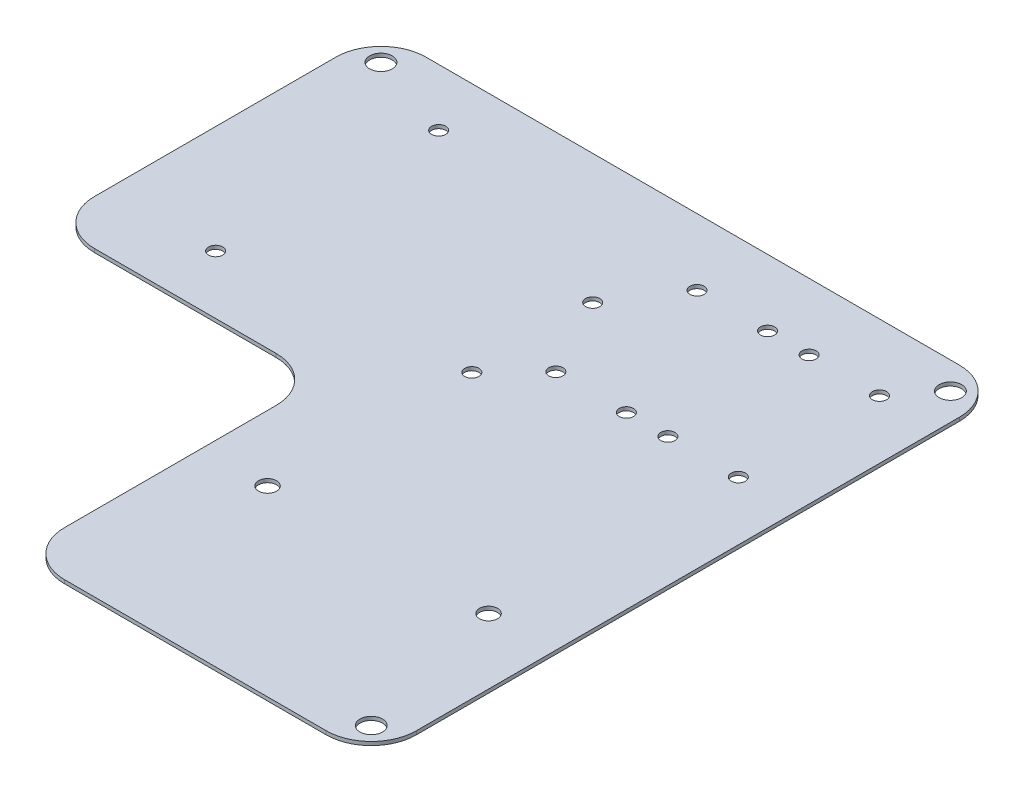
from build123d import *

# Parameters (mm, degrees)
SKETCH_1_R      = 1.57
SKETCH_1_R_2    = 2
SKETCH_1_R_3    = 2.5
EXTRUDE_1_DEPTH = 0.8


with BuildPart() as part:
    # 草图1 → 凸台-拉伸1 (new body)
    with BuildSketch(Plane(origin=(0, 0, 0), x_dir=(1, 0, 0), z_dir=(0, 1, 0))):
        with BuildLine():
            Line((-51.518366865, 90.405716602), (66.740135943, 90.405716602))
            ThreePointArc((66.740135943, 90.405716602), (73.811203755, 87.476784413), (76.740135943, 80.405716602))
            Line((76.740135943, 80.405716602), (76.740135943, 30.195483944))
            Line((76.740135943, 30.195483944), (76.740135943, -39.991264165))
            ThreePointArc((76.740135943, -39.991264165), (73.811203755, -47.062331977), (66.740135943, -49.991264165))
            Line((66.740135943, -49.991264165), (35.120135943, -49.991264165))
            Line((35.120135943, -49.991264165), (8.739202574, -49.991264165))
            ThreePointArc((8.739202574, -49.991264165), (1.668134763, -47.062331977), (-1.260797426, -39.991264165))
            Line((-1.260797426, -39.991264165), (-1.260797426, 6.905716602))
            ThreePointArc((-1.260797426, 6.905716602), (-4.189729614, 13.976784413), (-11.260797426, 16.905716602))
            Line((-11.260797426, 16.905716602), (-51.518366865, 16.905716602))
            ThreePointArc((-51.518366865, 16.905716602), (-58.589434677, 19.83464879), (-61.518366865, 26.905716602))
            Line((-61.518366865, 26.905716602), (-61.518366865, 80.405716602))
            ThreePointArc((-61.518366865, 80.405716602), (-58.589434677, 87.476784413), (-51.518366865, 90.405716602))
        make_face()
        with Locations(Location((-36.068366865, 77.755716602, 0), (0, 0, 270))):
            Circle(SKETCH_1_R, mode=Mode.SUBTRACT)
        with Locations(Location((23.290135943, 75.685716602, 0), (0, 0, 270))):
            Circle(SKETCH_1_R, mode=Mode.SUBTRACT)
        with Locations(Location((38.910135943, 75.685716602, 0), (0, 0, 270))):
            Circle(SKETCH_1_R, mode=Mode.SUBTRACT)
        with Locations(Location((48.120135943, 75.685716602, 0), (0, 0, 270))):
            Circle(SKETCH_1_R, mode=Mode.SUBTRACT)
        with Locations(Location((63.740135943, 75.685716602, 0), (0, 0, 270))):
            Circle(SKETCH_1_R, mode=Mode.SUBTRACT)
        with Locations(Location((-37.618366865, 29.855716602, 0), (0, 0, 270))):
            Circle(SKETCH_1_R, mode=Mode.SUBTRACT)
        with Locations(Location((14.081633135, 34.955716602, 0), (0, 0, 270))):
            Circle(SKETCH_1_R, mode=Mode.SUBTRACT)
        with Locations(Location((14.081633135, 61.755716602, 0), (0, 0, 270))):
            Circle(SKETCH_1_R, mode=Mode.SUBTRACT)
        with Locations(Location((23.290135943, 44.385716602, 0), (0, 0, 270))):
            Circle(SKETCH_1_R, mode=Mode.SUBTRACT)
        with Locations(Location((38.910135943, 44.385716602, 0), (0, 0, 270))):
            Circle(SKETCH_1_R, mode=Mode.SUBTRACT)
        with Locations(Location((48.120135943, 44.385716602, 0), (0, 0, 270))):
            Circle(SKETCH_1_R, mode=Mode.SUBTRACT)
        with Locations(Location((63.740135943, 44.385716602, 0), (0, 0, 270))):
            Circle(SKETCH_1_R, mode=Mode.SUBTRACT)
        with Locations(Location((13.239202574, -9.491264165, 0), (0, 0, 270))):
            Circle(SKETCH_1_R_2, mode=Mode.SUBTRACT)
        with Locations(Location((62.239202574, -9.491264165, 0), (0, 0, 270))):
            Circle(SKETCH_1_R_2, mode=Mode.SUBTRACT)
        with Locations(Location((-55.518366865, 84.405716602, 0), (0, 0, 270))):
            Circle(SKETCH_1_R_3, mode=Mode.SUBTRACT)
        with Locations(Location((70.740135943, 84.405716602, 0), (0, 0, 270))):
            Circle(SKETCH_1_R_3, mode=Mode.SUBTRACT)
        with Locations(Location((70.740135943, -43.991264165, 0), (0, 0, 270))):
            Circle(SKETCH_1_R_3, mode=Mode.SUBTRACT)
    extrude(amount=EXTRUDE_1_DEPTH)


solid = part.part
